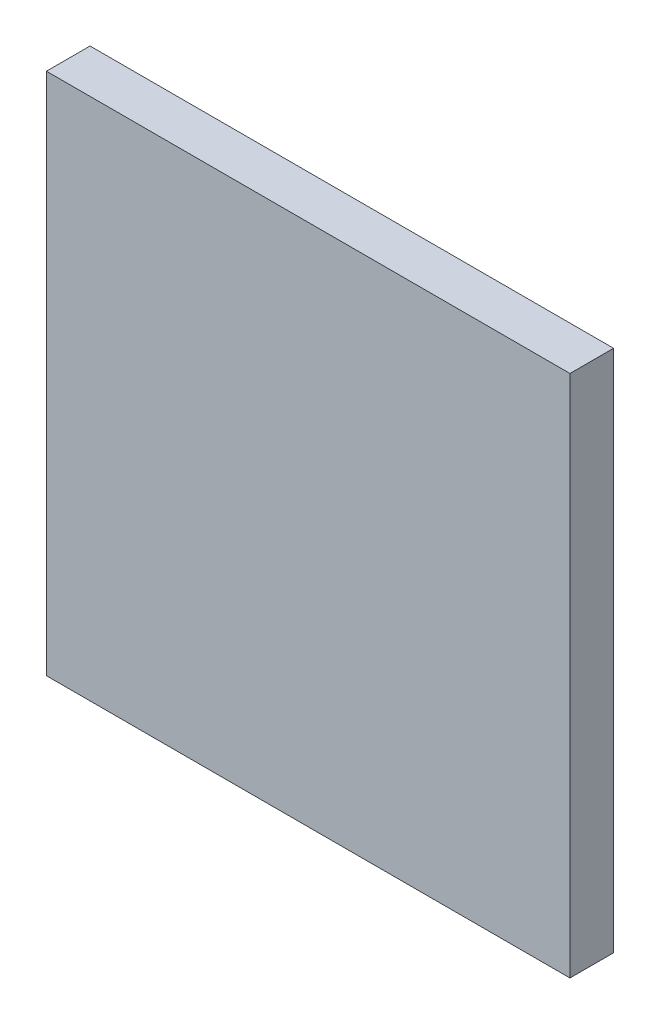
from build123d import *

# Parameters (mm, degrees)
SKETCH2_W           = 76.2
SKETCH2_H           = 76.2
BOSS_EXTRUDE1_DEPTH = 6.35


with BuildPart() as part:
    # Sketch2 → Boss-Extrude1 (new body)
    with BuildSketch(Plane.XY):
        with Locations((-41.821019108, 10.515923567)):
            Rectangle(SKETCH2_W, SKETCH2_H)
    extrude(amount=BOSS_EXTRUDE1_DEPTH)


solid = part.part
